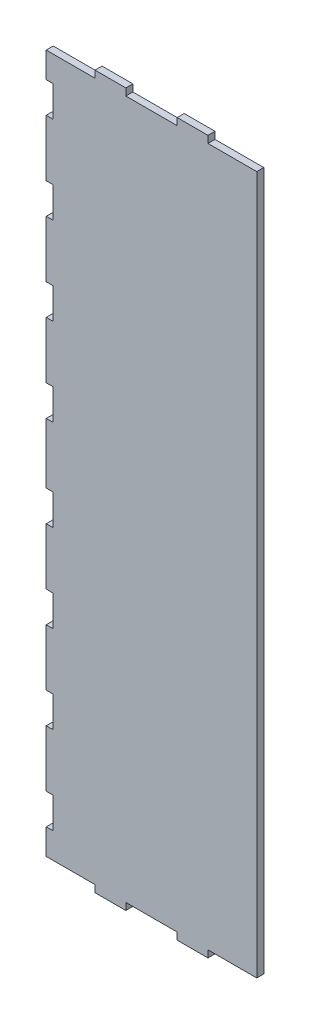
from build123d import *

# Parameters (mm, degrees)
SKETCH1_W           = 130.175
SKETCH1_H           = 431.8
BOSS_EXTRUDE1_DEPTH = 4.3434
SKETCH2_W           = 8.6868
SKETCH2_H           = 19.05
SKETCH2_W_2         = 19.05
SKETCH2_H_2         = 8.6868
CUT_EXTRUDE1_DEPTH  = 226.539481643
SKETCH3_W           = 19.05
SKETCH3_H           = 8.6868
BOSS_EXTRUDE2_DEPTH = 4.3434


with BuildPart() as part:
    # Sketch1 → Boss-Extrude1 (new body)
    with BuildSketch(Plane.XY):
        Rectangle(SKETCH1_W, SKETCH1_H)
    extrude(amount=BOSS_EXTRUDE1_DEPTH)

    # Sketch2 → Cut-Extrude1 (cut, through all)
    with BuildSketch(Plane.XY.offset(4.3434)):
        with Locations((-65.0875, 190.5)):
            Rectangle(SKETCH2_W, SKETCH2_H)
        with Locations((-25.4, 215.9)):
            Rectangle(SKETCH2_W_2, SKETCH2_H_2)
        with Locations((25.4, 215.9)):
            Rectangle(SKETCH2_W_2, SKETCH2_H_2)
        with Locations((-65.0875, 136.398)):
            Rectangle(SKETCH2_W, SKETCH2_H)
        with Locations((-65.0875, 82.296)):
            Rectangle(SKETCH2_W, SKETCH2_H)
        with Locations((-65.0875, 28.194)):
            Rectangle(SKETCH2_W, SKETCH2_H)
    cut_extrude1 = extrude(amount=-CUT_EXTRUDE1_DEPTH, mode=Mode.SUBTRACT)

    # Mirror1: Cut-Extrude1 across plane
    add(cut_extrude1.mirror(Plane.ZX), mode=Mode.SUBTRACT)

    # Sketch3 → Boss-Extrude2 (add)
    with BuildSketch(Plane.XY):
        with Locations((-25.4, 215.9)):
            Rectangle(SKETCH3_W, SKETCH3_H)
        with Locations((25.4, 215.9)):
            Rectangle(SKETCH3_W, SKETCH3_H)
    boss_extrude2 = extrude(amount=BOSS_EXTRUDE2_DEPTH)

    # Mirror2: Boss-Extrude2 across plane
    add(boss_extrude2.mirror(Plane.ZX))


solid = part.part
